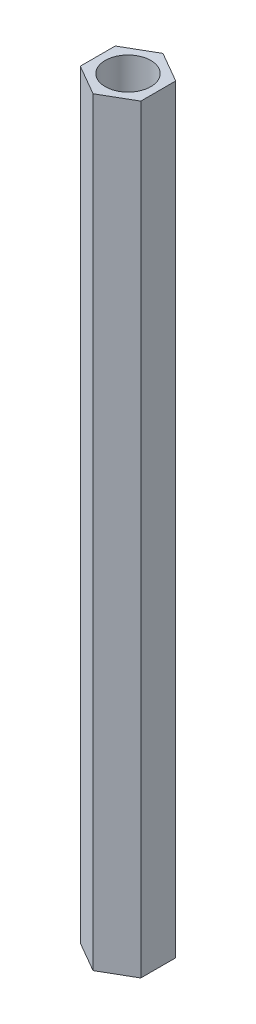
from build123d import *

# Parameters (mm, degrees)
SKETCH_1_R      = 1.5
EXTRUDE_1_DEPTH = 50


with BuildPart() as part:
    # 草图1 → 凸台-拉伸1 (new body)
    with BuildSketch(Plane(origin=(0, 0, 0), x_dir=(1, 0, 0), z_dir=(0, 1, 0))):
        Polygon((0, 2.3), (-1.991858429, 1.15), (-1.991858429, -1.15), (0, -2.3), (1.991858429, -1.15), (1.991858429, 1.15), align=None)
        with Locations(Location((0, 0, 0), (0, 0, 270))):
            Circle(SKETCH_1_R, mode=Mode.SUBTRACT)
    extrude(amount=EXTRUDE_1_DEPTH)


solid = part.part
